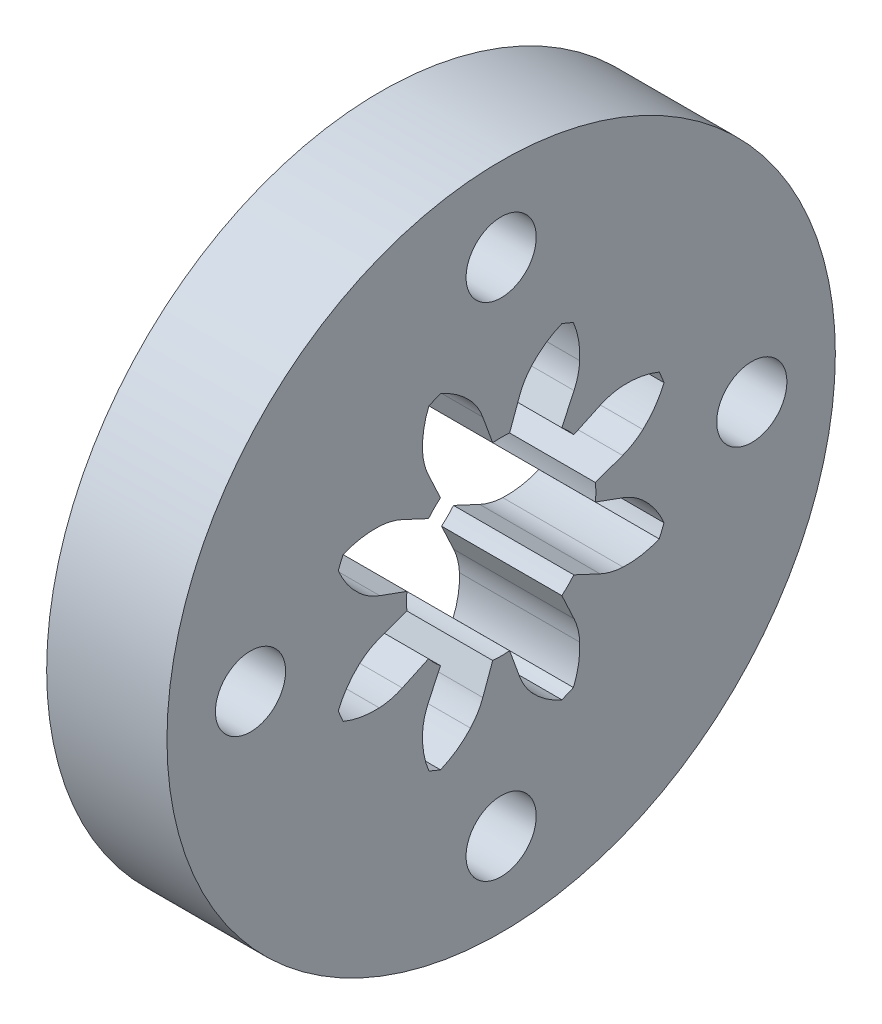
from build123d import *

# Parameters (mm, degrees)
ESBO_O1_W             = 7.2
ESBO_O1_H             = 20
CORTE_EXTRUS_O2_DEPTH = 30.186298155
FURO_ROSCADO_DE_M51_D = 4.2


with BuildPart() as part:
    # Esboço1 → Revolução1 (revolve)
    with BuildSketch(Plane.XY, mode=Mode.PRIVATE) as revolu_o1_sk:
        with Locations((3.6, 10)):
            Rectangle(ESBO_O1_W, ESBO_O1_H)
    revolve(revolu_o1_sk.sketch.rotate(Axis((-35, 0, 0), (1, 0, 0)), 90), axis=Axis((-35, 0, 0), (1, 0, 0)))

    # Esboço3 → Corte-extrusão2 (cut, through all)
    with BuildSketch(Plane(origin=(7.2, 0, 0), x_dir=(0, 0, -1), z_dir=(1, 0, 0))):
        with BuildLine():
            Line((-0.506751832, 5.642289215), (-1.097919721, 7.266509641))
            ThreePointArc((-1.097919721, 7.266509641), (-1.406126414, 7.910707201), (-1.832951119, 8.483247621))
            ThreePointArc((-1.832951119, 8.483247621), (-2.661618953, 9.214061597), (-3.630088541, 9.745894376))
            ThreePointArc((-3.630088541, 9.745894376), (-3.979907697, 9.608347138), (-4.324527778, 9.458248225))
            ThreePointArc((-4.324527778, 9.458248225), (-4.633276627, 8.397374248), (-4.702469753, 7.294654085))
            ThreePointArc((-4.702469753, 7.294654085), (-4.599433183, 6.587996228), (-4.361851763, 5.914544723))
            Line((-4.361851763, 5.914544723), (-3.631373309, 4.348028622))
            ThreePointArc((-3.631373309, 4.348028622), (-4.005759915, 4.005759915), (-4.348028622, 3.631373309))
            Line((-4.348028622, 3.631373309), (-5.914544723, 4.361851763))
            ThreePointArc((-5.914544723, 4.361851763), (-6.587996228, 4.599433183), (-7.294654085, 4.702469753))
            ThreePointArc((-7.294654085, 4.702469753), (-8.397374248, 4.633276627), (-9.458248225, 4.324527778))
            ThreePointArc((-9.458248225, 4.324527778), (-9.608347138, 3.979907697), (-9.745894376, 3.630088541))
            ThreePointArc((-9.745894376, 3.630088541), (-9.214061597, 2.661618953), (-8.483247621, 1.832951119))
            ThreePointArc((-8.483247621, 1.832951119), (-7.910707201, 1.406126414), (-7.266509641, 1.097919721))
            Line((-7.266509641, 1.097919721), (-5.642289215, 0.506751832))
            ThreePointArc((-5.642289215, 0.506751832), (-5.665, 0), (-5.642289215, -0.506751832))
            Line((-5.642289215, -0.506751832), (-7.266509641, -1.097919721))
            ThreePointArc((-7.266509641, -1.097919721), (-7.910707201, -1.406126414), (-8.483247621, -1.832951119))
            ThreePointArc((-8.483247621, -1.832951119), (-9.214061597, -2.661618953), (-9.745894376, -3.630088541))
            ThreePointArc((-9.745894376, -3.630088541), (-9.608347138, -3.979907697), (-9.458248225, -4.324527778))
            ThreePointArc((-9.458248225, -4.324527778), (-8.397374248, -4.633276627), (-7.294654085, -4.702469753))
            ThreePointArc((-7.294654085, -4.702469753), (-6.587996228, -4.599433183), (-5.914544723, -4.361851763))
            Line((-5.914544723, -4.361851763), (-4.348028622, -3.631373309))
            ThreePointArc((-4.348028622, -3.631373309), (-4.005759915, -4.005759915), (-3.631373309, -4.348028622))
            Line((-3.631373309, -4.348028622), (-4.361851763, -5.914544723))
            ThreePointArc((-4.361851763, -5.914544723), (-4.599433183, -6.587996228), (-4.702469753, -7.294654085))
            ThreePointArc((-4.702469753, -7.294654085), (-4.633276627, -8.397374248), (-4.324527778, -9.458248225))
            ThreePointArc((-4.324527778, -9.458248225), (-3.979907697, -9.608347138), (-3.630088541, -9.745894376))
            ThreePointArc((-3.630088541, -9.745894376), (-2.661618953, -9.214061597), (-1.832951119, -8.483247621))
            ThreePointArc((-1.832951119, -8.483247621), (-1.406126414, -7.910707201), (-1.097919721, -7.266509641))
            Line((-1.097919721, -7.266509641), (-0.506751832, -5.642289215))
            ThreePointArc((-0.506751832, -5.642289215), (0, -5.665), (0.506751832, -5.642289215))
            Line((0.506751832, -5.642289215), (1.097919721, -7.266509641))
            ThreePointArc((1.097919721, -7.266509641), (1.406126414, -7.910707201), (1.832951119, -8.483247621))
            ThreePointArc((1.832951119, -8.483247621), (2.661618953, -9.214061597), (3.630088541, -9.745894376))
            ThreePointArc((3.630088541, -9.745894376), (3.979907697, -9.608347138), (4.324527778, -9.458248225))
            ThreePointArc((4.324527778, -9.458248225), (4.633276627, -8.397374248), (4.702469753, -7.294654085))
            ThreePointArc((4.702469753, -7.294654085), (4.599433183, -6.587996228), (4.361851763, -5.914544723))
            Line((4.361851763, -5.914544723), (3.631373309, -4.348028622))
            ThreePointArc((3.631373309, -4.348028622), (4.005759915, -4.005759915), (4.348028622, -3.631373309))
            Line((4.348028622, -3.631373309), (5.914544723, -4.361851763))
            ThreePointArc((5.914544723, -4.361851763), (6.587996228, -4.599433183), (7.294654085, -4.702469753))
            ThreePointArc((7.294654085, -4.702469753), (8.397374248, -4.633276627), (9.458248225, -4.324527778))
            ThreePointArc((9.458248225, -4.324527778), (9.608347138, -3.979907697), (9.745894376, -3.630088541))
            ThreePointArc((9.745894376, -3.630088541), (9.214061597, -2.661618953), (8.483247621, -1.832951119))
            ThreePointArc((8.483247621, -1.832951119), (7.910707201, -1.406126414), (7.266509641, -1.097919721))
            Line((7.266509641, -1.097919721), (5.642289215, -0.506751832))
            ThreePointArc((5.642289215, -0.506751832), (5.665, 0), (5.642289215, 0.506751832))
            Line((5.642289215, 0.506751832), (7.266509641, 1.097919721))
            ThreePointArc((7.266509641, 1.097919721), (7.910707201, 1.406126414), (8.483247621, 1.832951119))
            ThreePointArc((8.483247621, 1.832951119), (9.214061597, 2.661618953), (9.745894376, 3.630088541))
            ThreePointArc((9.745894376, 3.630088541), (9.608347138, 3.979907697), (9.458248225, 4.324527778))
            ThreePointArc((9.458248225, 4.324527778), (8.397374248, 4.633276627), (7.294654085, 4.702469753))
            ThreePointArc((7.294654085, 4.702469753), (6.587996228, 4.599433183), (5.914544723, 4.361851763))
            Line((5.914544723, 4.361851763), (4.348028622, 3.631373309))
            ThreePointArc((4.348028622, 3.631373309), (4.005759915, 4.005759915), (3.631373309, 4.348028622))
            Line((3.631373309, 4.348028622), (4.361851763, 5.914544723))
            ThreePointArc((4.361851763, 5.914544723), (4.599433183, 6.587996228), (4.702469753, 7.294654085))
            ThreePointArc((4.702469753, 7.294654085), (4.633276627, 8.397374248), (4.324527778, 9.458248225))
            ThreePointArc((4.324527778, 9.458248225), (3.979907697, 9.608347138), (3.630088541, 9.745894376))
            ThreePointArc((3.630088541, 9.745894376), (2.661618953, 9.214061597), (1.832951119, 8.483247621))
            ThreePointArc((1.832951119, 8.483247621), (1.406126414, 7.910707201), (1.097919721, 7.266509641))
            Line((1.097919721, 7.266509641), (0.506751832, 5.642289215))
            ThreePointArc((0.506751832, 5.642289215), (0, 5.665), (-0.506751832, 5.642289215))
        make_face()
    extrude(amount=-CORTE_EXTRUS_O2_DEPTH, mode=Mode.SUBTRACT)

    # Furo roscado de M51 (through all)
    with Locations(Plane(origin=(7.2, 0, 0), x_dir=(0, 0, -1), z_dir=(1, 0, 0))):
        with Locations((0, 15), (15, 0), (0, -15), (-15, 0)):
            Hole(FURO_ROSCADO_DE_M51_D / 2)


solid = part.part
